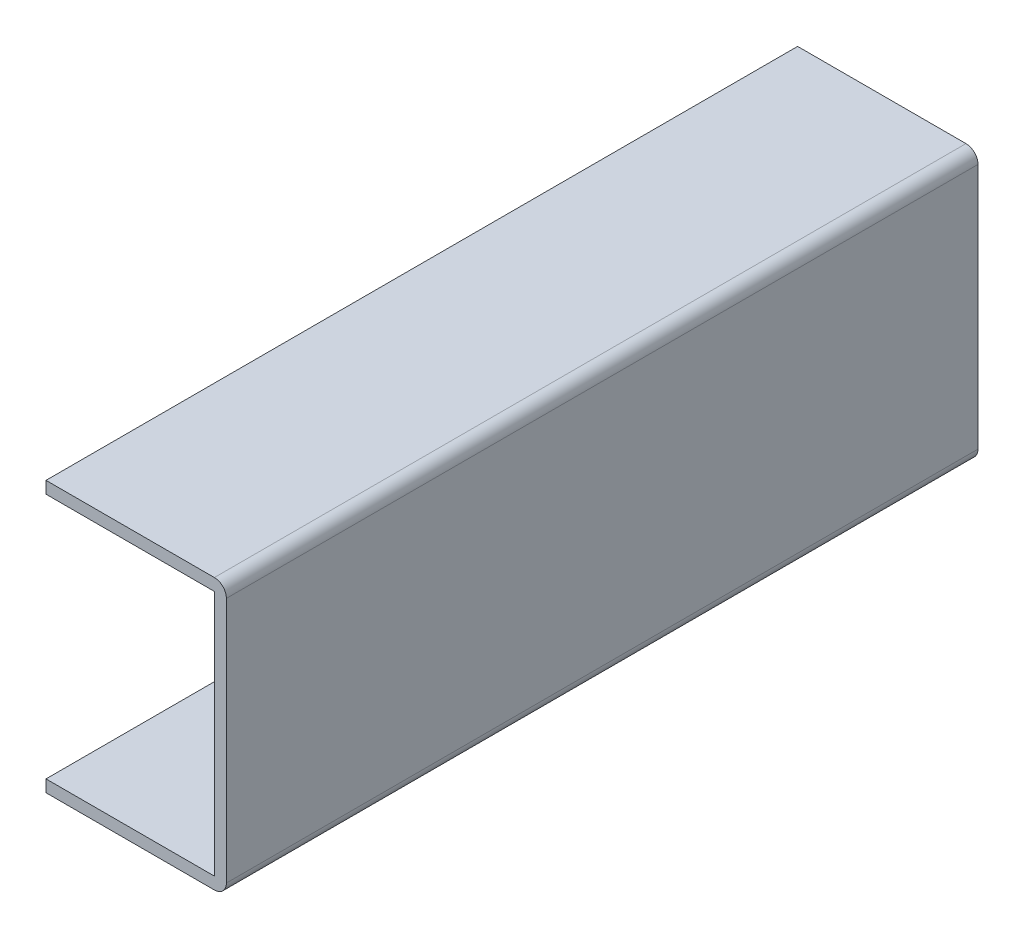
from build123d import *

# Parameters (mm, degrees)
RESSALTO_EXTRUS_O1_DEPTH = 1.25
FILETE1_R                = 0.02
FILETE2_R                = 0.02


with BuildPart() as part:
    # Esboço1 → Ressalto-extrusão1 (new body)
    with BuildSketch(Plane.XY):
        Polygon((-8.012095627, -28.751761562), (-7.732095627, -28.751761562), (-7.732095627, -29.161761562), (-8.012095627, -29.161761562), (-8.012095627, -29.181761562), (-7.712095627, -29.181761562), (-7.712095627, -28.731761562), (-8.012095627, -28.731761562), align=None)
    extrude(amount=RESSALTO_EXTRUS_O1_DEPTH)

    # Filete1
    filete1_edges = [part.edges().sort_by_distance(p)[0] for p in [
        (-7.712095627, -28.731761562, 0.625),
    ]]
    fillet(filete1_edges, radius=FILETE1_R)

    # Filete2
    filete2_edges = [part.edges().sort_by_distance(p)[0] for p in [
        (-7.712095627, -29.181761562, 0.625),
    ]]
    fillet(filete2_edges, radius=FILETE2_R)


solid = part.part
